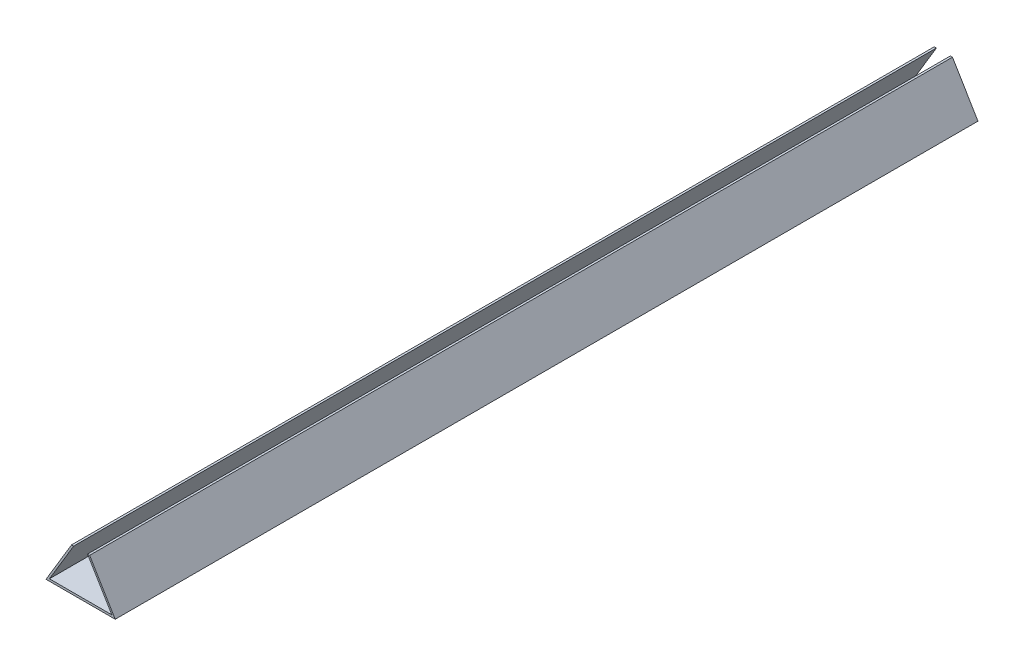
from build123d import *

# Parameters (mm, degrees)
SALIENTE_EXTRUIR1_DEPTH = 810


with BuildPart() as part:
    # Croquis1 → Saliente-Extruir1 (new body)
    with BuildSketch(Plane.XY):
        Polygon((-32.5, 0), (32.5, 0), (8.5, 40), (6.5, 40), (29.3, 2), (-29.3, 2), (-6.5, 40), (-8.5, 40), align=None)
    extrude(amount=SALIENTE_EXTRUIR1_DEPTH)


solid = part.part
